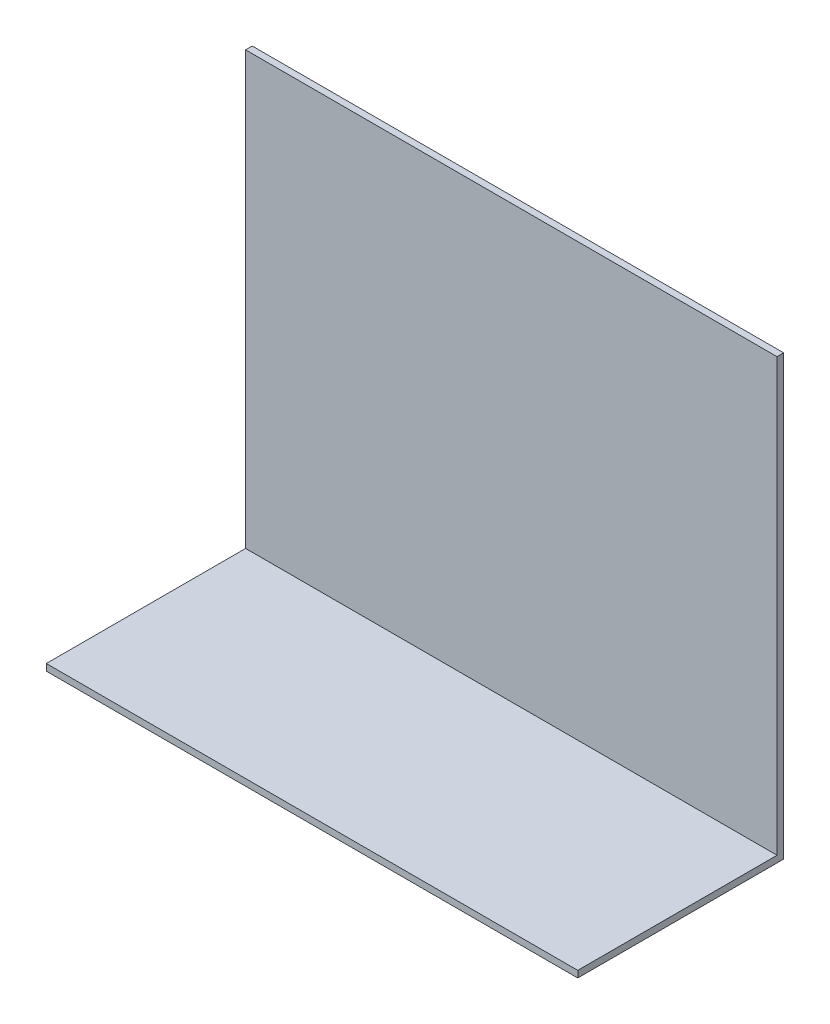
from build123d import *

# Parameters (mm, degrees)
SKETCH1_W           = 400
SKETCH1_H           = 330
BOSS_EXTRUDE1_DEPTH = 5
BOSS_EXTRUDE2_START = 5
SKETCH2_W           = 400
SKETCH2_H           = 5
BOSS_EXTRUDE2_DEPTH = 150


with BuildPart() as part:
    # Sketch1 → Boss-Extrude1 (new body)
    with BuildSketch(Plane.XY):
        Rectangle(SKETCH1_W, SKETCH1_H)
    extrude(amount=BOSS_EXTRUDE1_DEPTH)

    # Sketch2 → Boss-Extrude2 (add)
    with BuildSketch(Plane.XY.offset(BOSS_EXTRUDE2_START)):
        with Locations((0, -162.5)):
            Rectangle(SKETCH2_W, SKETCH2_H)
    extrude(amount=BOSS_EXTRUDE2_DEPTH)


solid = part.part
